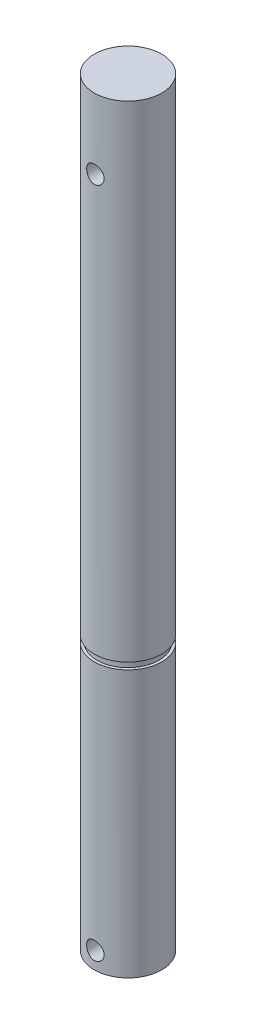
from build123d import *

# Parameters (mm, degrees)
SKETCH1_R               = 3.175
BOSS_EXTRUDE1_DEPTH     = 38.1
SKETCH2_R               = 7.237173009
CUT_EXTRUDE1_DEPTH      = 4.7625
CUT_EXTRUDE2_DEPTH      = 39.363670966
CUT_EXTRUDE2_DEPTH_BACK = 39.363670966
SKETCH4_R               = 0.8255
SKETCH5_R               = 3.175
SKETCH5_R_2             = 2.916705682
CUT_EXTRUDE3_DEPTH      = 0.635


with BuildPart() as part:
    # Sketch1 → Boss-Extrude1 (new, symmetric)
    with BuildSketch(Plane(origin=(0, 0, 0), x_dir=(1, 0, 0), z_dir=(0, 1, 0))):
        with Locations(Location((0, 0, 0), (0, 0, 90))):
            Circle(SKETCH1_R)
    extrude(amount=BOSS_EXTRUDE1_DEPTH, both=True)

    # Sketch2 → Cut-Extrude1 (cut)
    with BuildSketch(Plane.XZ.offset(38.1)):
        with Locations((0, 0.163997739)):
            Circle(SKETCH2_R)
    extrude(amount=-CUT_EXTRUDE1_DEPTH, mode=Mode.SUBTRACT)

    # Sketch4 → Cut-Extrude2 (cut, two sides: drawn at the far end of the back side and taken through both)
    with BuildSketch(Plane.XY.offset(-CUT_EXTRUDE2_DEPTH_BACK)):
        with Locations((0, 31.489271019)):
            Circle(SKETCH4_R)
        with Locations((0, -31.74365)):
            Circle(SKETCH4_R)
    extrude(amount=CUT_EXTRUDE2_DEPTH + CUT_EXTRUDE2_DEPTH_BACK, mode=Mode.SUBTRACT)

    # Sketch5 → Cut-Extrude3 (cut)
    with BuildSketch(Plane.XZ.offset(7.6073)):
        with Locations(Location((0, 0, 0), (0, 0, 270))):
            Circle(SKETCH5_R)
        Circle(SKETCH5_R_2, mode=Mode.SUBTRACT)
    extrude(amount=CUT_EXTRUDE3_DEPTH, mode=Mode.SUBTRACT)


solid = part.part
